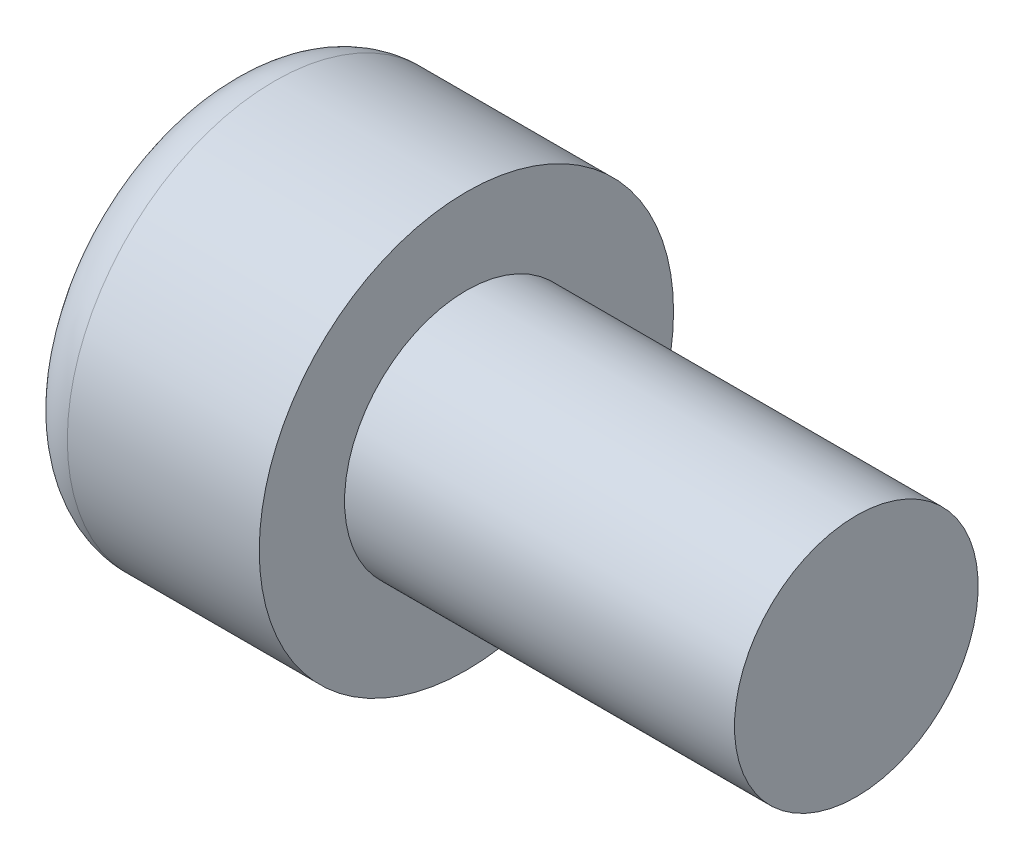
from build123d import *

# Parameters (mm, degrees)
CUT_EXTRUDE1_DEPTH = 2.5


with BuildPart() as part:
    # Sketch1 → Revolve1 (revolve)
    with BuildSketch(Plane.XY, mode=Mode.PRIVATE) as revolve1_sk:
        with BuildLine():
            Line((0, 0), (0, 3.1875))
            ThreePointArc((0, 3.1875), (0.311199045, 3.938800955), (1.0625, 4.25))
            Line((1.0625, 4.25), (5, 4.25))
            Line((5, 4.25), (5, 2.5))
            Line((5, 2.5), (13, 2.5))
            Line((13, 2.5), (13, 0))
            Line((13, 0), (0, 0))
        make_face()
    revolve(revolve1_sk.sketch.rotate(Axis((0, 0, 0), (1, 0, 0)), 180), axis=Axis((0, 0, 0), (1, 0, 0)))

    # Sketch2 → Cut-Extrude1 (cut)
    with BuildSketch(Plane.ZY):
        Polygon((0, 2.309401077), (-2, 1.154700538), (-2, -1.154700538), (0, -2.309401077), (2, -1.154700538), (2, 1.154700538), align=None)
    extrude(amount=-CUT_EXTRUDE1_DEPTH, mode=Mode.SUBTRACT)


solid = part.part
